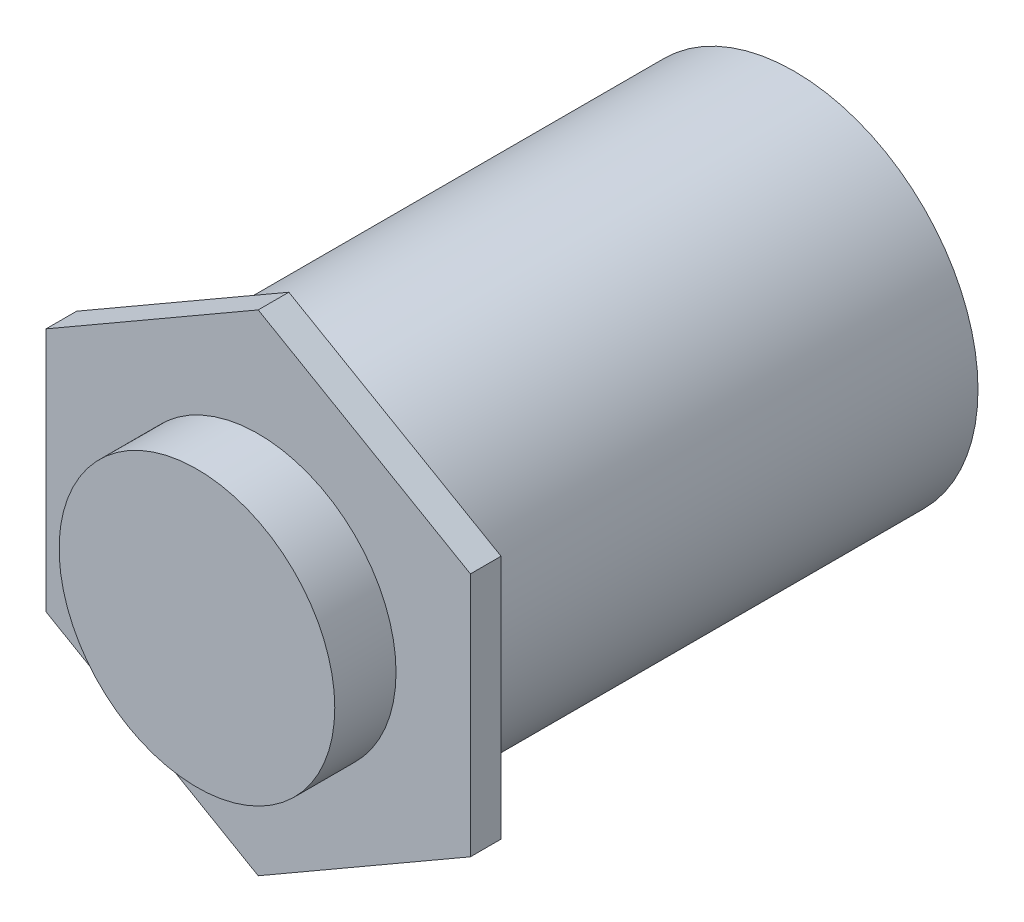
from build123d import *

# Parameters (mm, degrees)
SKETCH_1_R      = 6
EXTRUDE_1_DEPTH = 16.5
EXTRUDE_2_DEPTH = 1
SKETCH_3_R      = 4.5
EXTRUDE_3_DEPTH = 2


with BuildPart() as part:
    # 草图1 → 凸台-拉伸1 (new body)
    with BuildSketch(Plane.XY):
        Circle(SKETCH_1_R)
    extrude(amount=EXTRUDE_1_DEPTH)

    # 草图2 → 凸台-拉伸2 (add)
    with BuildSketch(Plane.XY.offset(16.5)):
        Polygon((0, 8), (-6.92820323, 4), (-6.92820323, -4), (0, -8), (6.92820323, -4), (6.92820323, 4), align=None)
    extrude(amount=EXTRUDE_2_DEPTH)

    # 草图3 → 凸台-拉伸3 (add)
    with BuildSketch(Plane.XY.offset(17.5)):
        Circle(SKETCH_3_R)
    extrude(amount=EXTRUDE_3_DEPTH)


solid = part.part
